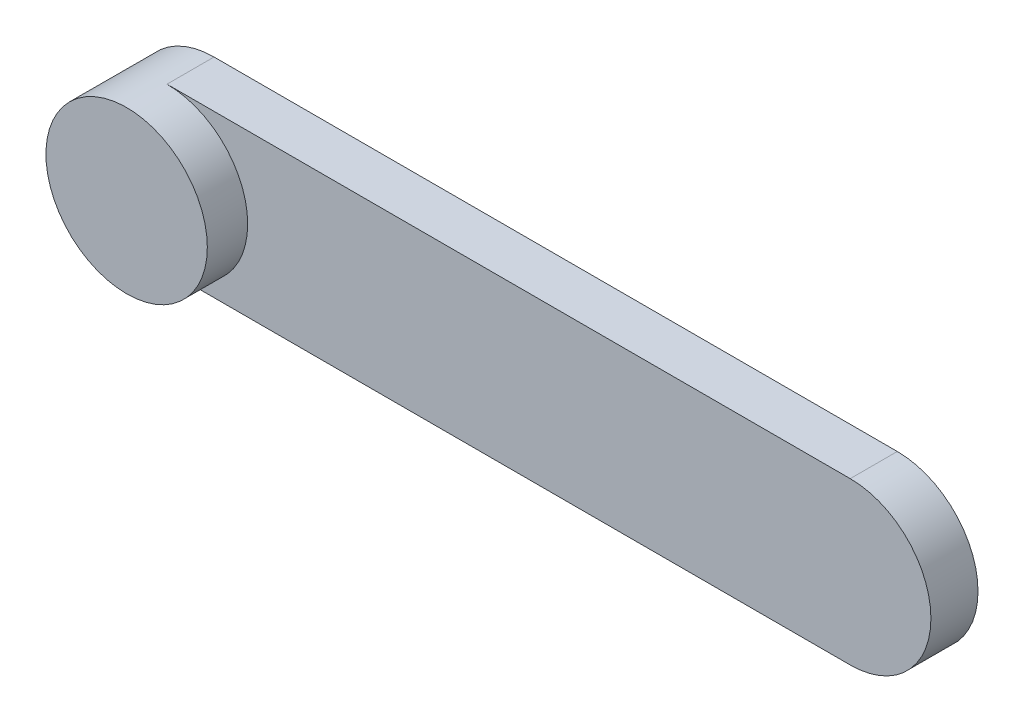
from build123d import *

# Parameters (mm, degrees)
EXTRUDE_1_DEPTH = 1.75
EXTRUDE_START   = 3
SKETCH_2_R      = 6
EXTRUDE_2_DEPTH = 3


with BuildPart() as part:
    # 草图1 → 凸台-拉伸1 (new, symmetric)
    with BuildSketch(Plane.XY):
        with BuildLine():
            Line((0, 6), (50.8, 6))
            ThreePointArc((50.8, 6), (56.8, 0), (50.8, -6))
            Line((50.8, -6), (0, -6))
            ThreePointArc((0, -6), (-6, 0), (0, 6))
        make_face()
    extrude(amount=EXTRUDE_1_DEPTH, both=True)

    # 草图2 → 凸台-拉伸2 (add)
    with BuildSketch(Plane.XY.offset(1.75).offset(EXTRUDE_START)):
        with Locations(Location((0, 0, 0), (0, 0, 270))):
            Circle(SKETCH_2_R)
    extrude(amount=-EXTRUDE_2_DEPTH)


solid = part.part
